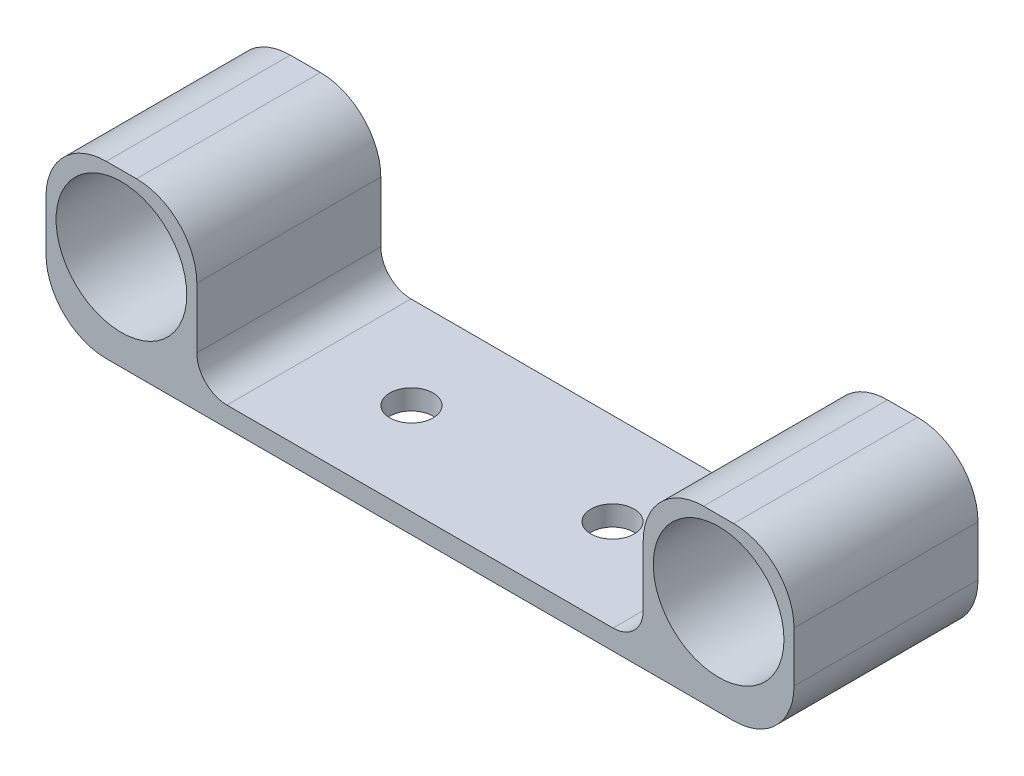
from build123d import *

# Parameters (mm, degrees)
SKETCH1_W           = 15
SKETCH1_H           = 18.3
SKETCH1_W_2         = 44.4
SKETCH1_R           = 2.15
BOSS_EXTRUDE1_DEPTH = 2
SKETCH1_3_W         = 15
SKETCH1_3_H         = 18.3
BOSS_EXTRUDE2_DEPTH = 17
SKETCH2_R           = 6.5
CUT_EXTRUDE2_DEPTH  = 12.315
FILLET3_R           = 6
FILLET4_R           = 3


with BuildPart() as part:
    # Sketch1 → Boss-Extrude1 (new body)
    # profile 1 of 3: a face of its own
    with BuildSketch(Plane(origin=(0, 0, 0), x_dir=(1, 0, 0), z_dir=(0, 1, 0))):
        with Locations((-7.5, 9.15)):
            Rectangle(SKETCH1_W, SKETCH1_H)
    # profile 2 of 3: a face of its own
    with BuildSketch(Plane(origin=(0, 0, 0), x_dir=(1, 0, 0), z_dir=(0, 1, 0))):
        with Locations((22.2, 9.15)):
            Rectangle(SKETCH1_W_2, SKETCH1_H)
        with Locations(Location((32.2, 9.15, 0), (0, 0, 270))):
            Circle(SKETCH1_R, mode=Mode.SUBTRACT)
        with Locations(Location((12.2, 9.15, 0), (0, 0, 270))):
            Circle(SKETCH1_R, mode=Mode.SUBTRACT)
    # profile 3 of 3: a face of its own
    with BuildSketch(Plane(origin=(0, 0, 0), x_dir=(1, 0, 0), z_dir=(0, 1, 0))):
        with Locations((51.9, 9.15)):
            Rectangle(SKETCH1_W, SKETCH1_H)
    extrude(amount=BOSS_EXTRUDE1_DEPTH)

    # Sketch1<3> → Boss-Extrude2 (add)
    with BuildSketch(Plane(origin=(0, 0, 0), x_dir=(1, 0, 0), z_dir=(0, 1, 0))):
        with Locations((51.9, 9.15)):
            Rectangle(SKETCH1_3_W, SKETCH1_3_H)
        with Locations((-7.5, 9.15)):
            Rectangle(SKETCH1_3_W, SKETCH1_3_H)
    extrude(amount=BOSS_EXTRUDE2_DEPTH)

    # Sketch2 → Cut-Extrude2 (cut)
    with BuildSketch(Plane.XY):
        with Locations((-7.5, 9.5)):
            Circle(SKETCH2_R)
        with Locations((51.9, 9.5)):
            Circle(SKETCH2_R)
    extrude(amount=-CUT_EXTRUDE2_DEPTH, mode=Mode.SUBTRACT)

    # Fillet3
    fillet3_edges = [part.edges().sort_by_distance(p)[0] for p in [
        (59.4, 0, -9.15),
        (-15, 0, -9.15),
        (44.4, 17, -9.15),
        (59.4, 17, -9.15),
        (-15, 17, -9.15),
        (0, 17, -9.15),
    ]]
    fillet(fillet3_edges, radius=FILLET3_R)

    # Fillet4
    fillet4_edges = [part.edges().sort_by_distance(p)[0] for p in [
        (44.4, 2, -9.15),
        (0, 2, -9.15),
    ]]
    fillet(fillet4_edges, radius=FILLET4_R)


solid = part.part
